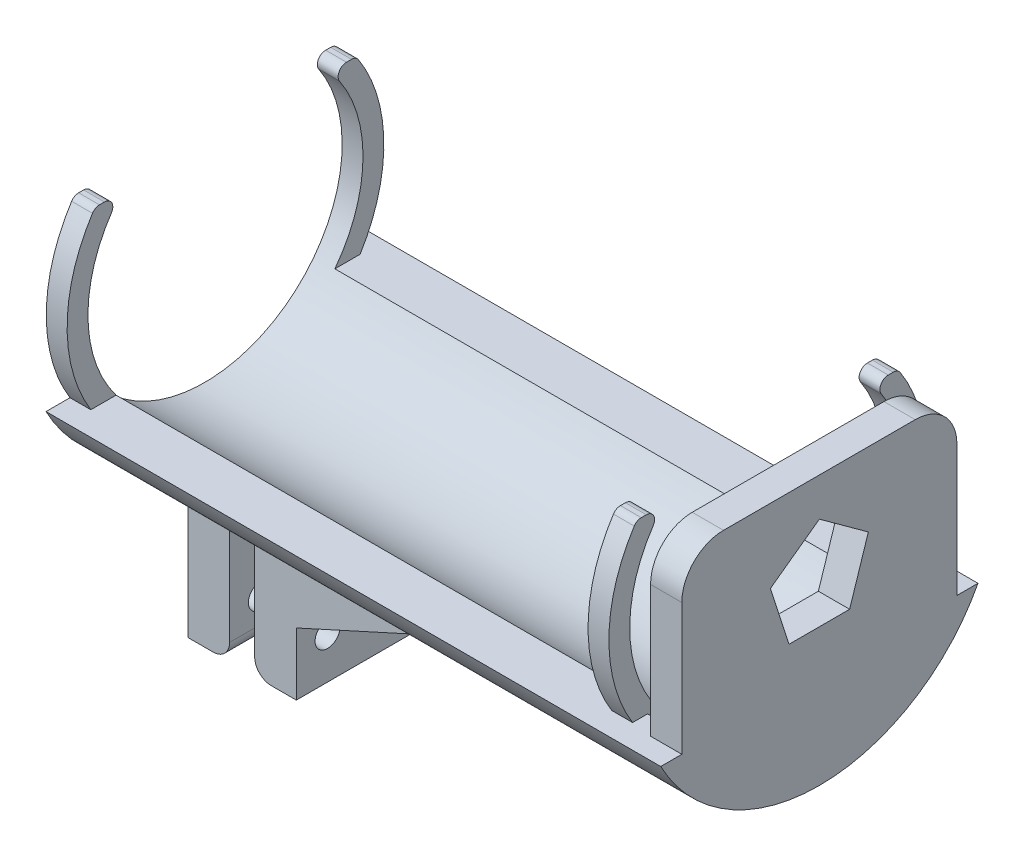
from build123d import *

# Parameters (mm, degrees)
BOSS_EXTRUDE1_DEPTH   = 70
BOSS_EXTRUDE2_START   = -5
BOSS_EXTRUDE2_DEPTH   = 5
BOSS_EXTRUDE3_START   = 7.5
BOSS_EXTRUDE3_DEPTH   = 7.5
BOSS_EXTRUDE4_DEPTH   = 15
BOSS_EXTRUDE4_2_DEPTH = 15
BOSS_EXTRUDE6_REACH   = 109.8
SKETCH5_W             = 43
SKETCH5_H             = 30
SKETCH5_W_2           = 10
CUT_EXTRUDE1_REACH    = 161.406
SKETCH6_R             = 3
SKETCH7_R             = 35
CUT_EXTRUDE2_DEPTH    = 5
LPATTERN1_COUNT       = 2
LPATTERN1_PITCH       = 130
FILLET1_R             = 2
CUT_EXTRUDE3_REACH    = 164.413


with BuildPart() as part:
    # Sketch1 → Boss-Extrude1 (new, symmetric)
    with BuildSketch(Plane(origin=(0, 0, 0), x_dir=(0, 0, -1), z_dir=(1, 0, 0))):
        with BuildLine():
            Line((-38.065732621, -20), (-26.248809497, -20))
            ThreePointArc((-26.248809497, -20), (0, -33), (26.248809497, -20))
            Line((26.248809497, -20), (38.065732621, -20))
            ThreePointArc((38.065732621, -20), (0, -43), (-38.065732621, -20))
        make_face()
    extrude(amount=BOSS_EXTRUDE1_DEPTH, both=True)

    # Sketch2 → Boss-Extrude2 (add)
    with BuildSketch(Plane(origin=(70, 0, 0), x_dir=(0, 0, -1), z_dir=(1, 0, 0)).offset(BOSS_EXTRUDE2_START)):
        with BuildLine():
            Line((-31.304951685, 21.540659229), (-25, 21.540659229))
            ThreePointArc((-25, 21.540659229), (0, -33), (25, 21.540659229))
            Line((25, 21.540659229), (31.304951685, 21.540659229))
            ThreePointArc((31.304951685, 21.540659229), (0, -38), (-31.304951685, 21.540659229))
        make_face()
    boss_extrude2 = extrude(amount=-BOSS_EXTRUDE2_DEPTH)

    # Sketch3 → Boss-Extrude3 (add)
    with BuildSketch(Plane(origin=(70, 0, 0), x_dir=(0, 0, -1), z_dir=(1, 0, 0)).offset(BOSS_EXTRUDE3_START)):
        with BuildLine():
            Line((-33, -20), (-33, 11.540659229))
            ThreePointArc((-33, 11.540659229), (-30.071067812, 18.61172704), (-23, 21.540659229))
            Line((-23, 21.540659229), (23, 21.540659229))
            ThreePointArc((23, 21.540659229), (30.071067812, 18.61172704), (33, 11.540659229))
            Line((33, 11.540659229), (33, -20))
            Line((33, -20), (38.065732621, -20))
            ThreePointArc((38.065732621, -20), (0, -43), (-38.065732621, -20))
            Line((-38.065732621, -20), (-33, -20))
        make_face()
    extrude(amount=-BOSS_EXTRUDE3_DEPTH)

    # Sketch5 → Boss-Extrude6 (add, up to next)
    with BuildSketch(Plane(origin=(0, -43, 0), x_dir=(1, 0, 0), z_dir=(0, 1, 0)), mode=Mode.PRIVATE) as boss_extrude6_sk1:
        with Locations((-21.5, 0)):
            Rectangle(SKETCH5_W, SKETCH5_H)
    boss_extrude6_tool1 = extrude(boss_extrude6_sk1.sketch, amount=BOSS_EXTRUDE6_REACH, mode=Mode.PRIVATE) - part.part
    # Sketch5 → Boss-Extrude6 (add, up to next)
    with BuildSketch(Plane(origin=(0, -43, 0), x_dir=(1, 0, 0), z_dir=(0, 1, 0)), mode=Mode.PRIVATE) as boss_extrude6_sk2:
        with Locations((-54, 0)):
            Rectangle(SKETCH5_W_2, SKETCH5_H)
    boss_extrude6_tool2 = extrude(boss_extrude6_sk2.sketch, amount=BOSS_EXTRUDE6_REACH, mode=Mode.PRIVATE) - part.part


with BuildPart() as body_2:
    # Sketch4 → Boss-Extrude4 (new, symmetric)
    with BuildSketch(Plane.XY):
        with BuildLine():
            Line((-49, -43), (-49, -69))
            ThreePointArc((-49, -69), (-50.171572875, -71.828427125), (-53, -73))
            Line((-53, -73), (-59, -73))
            Line((-59, -73), (-59, -43))
            Line((-59, -43), (-49, -43))
        make_face()
    extrude(amount=BOSS_EXTRUDE4_DEPTH, both=True)


with BuildPart() as body_3:
    # Sketch4 → Boss-Extrude4 2 (new, symmetric)
    with BuildSketch(Plane.XY):
        with BuildLine():
            Line((-33, -43), (-43, -43))
            Line((-43, -43), (-43, -69))
            ThreePointArc((-43, -69), (-41.828427125, -71.828427125), (-39, -73))
            Line((-39, -73), (-33, -73))
            Line((-33, -73), (-33, -58))
            Line((-33, -58), (0, -43))
            Line((0, -43), (-33, -43))
        make_face()
    extrude(amount=BOSS_EXTRUDE4_2_DEPTH, both=True)


with BuildPart() as part_1:
    add(part.part)

    add(body_2.part)  # Boss-Extrude6 merges body 2

    add(body_3.part)  # Boss-Extrude6 merges body 3
    add(boss_extrude6_tool1.solids().sort_by_distance((-21.5, -43, 0))[0])
    add(boss_extrude6_tool1.solids().sort_by_distance((-21.5, -43, 0))[1])
    add(boss_extrude6_tool2.solids().sort_by_distance((-54, -43, 0))[0])
    add(boss_extrude6_tool2.solids().sort_by_distance((-54, -43, 0))[1])

    # Cut-Extrude1: up to this face of the body (flat: up to its plane)
    cut_extrude1_end = Plane(part_1.part.faces().sort_by_distance((-33, -65.5, 0))[0])
    # Sketch6 → Cut-Extrude1 (cut, up to the picked face)
    with BuildSketch(Plane.ZY.offset(59), mode=Mode.PRIVATE) as cut_extrude1_sk1:
        with Locations((-7.5, -63)):
            Circle(SKETCH6_R)
    cut_extrude1_tool1 = split(extrude(cut_extrude1_sk1.sketch, amount=-CUT_EXTRUDE1_REACH, mode=Mode.PRIVATE), bisect_by=cut_extrude1_end, keep=Keep.BOTH, mode=Mode.PRIVATE)
    # Sketch6 → Cut-Extrude1 (cut, up to the picked face)
    with BuildSketch(Plane.ZY.offset(59), mode=Mode.PRIVATE) as cut_extrude1_sk2:
        with Locations((7.5, -63)):
            Circle(SKETCH6_R)
    cut_extrude1_tool2 = split(extrude(cut_extrude1_sk2.sketch, amount=-CUT_EXTRUDE1_REACH, mode=Mode.PRIVATE), bisect_by=cut_extrude1_end, keep=Keep.BOTH, mode=Mode.PRIVATE)
    add(cut_extrude1_tool1.solids().sort_by(Axis((-59, -63, -7.5), (1, 0, 0)))[0], mode=Mode.SUBTRACT)
    add(cut_extrude1_tool2.solids().sort_by(Axis((-59, -63, 7.5), (1, 0, 0)))[0], mode=Mode.SUBTRACT)

    # Sketch7 → Cut-Extrude2 (cut)
    with BuildSketch(Plane.ZY.offset(-70)):
        Circle(SKETCH7_R)
    extrude(amount=CUT_EXTRUDE2_DEPTH, mode=Mode.SUBTRACT)

    # LPattern1: Boss-Extrude2 ×2
    with Locations(*[(-i * LPATTERN1_PITCH, 0, 0) for i in range(1, LPATTERN1_COUNT)]):
        add(boss_extrude2)

    # Fillet1
    fillet1_edges = [part_1.edges().sort_by_distance(p)[0] for p in [
        (62.5, 21.540659229, 25),
        (62.5, 21.540659229, -31.304951685),
        (-67.5, 21.540659229, 25),
        (-67.5, 21.540659229, -31.304951685),
        (-67.5, 21.540659229, -25),
        (-67.5, 21.540659229, 31.304951685),
        (62.5, 21.540659229, -25),
        (62.5, 21.540659229, 31.304951685),
    ]]
    fillet(fillet1_edges, radius=FILLET1_R)

    # Sketch8 → Cut-Extrude3 (cut, up to next)
    with BuildSketch(Plane.ZY.offset(-70), mode=Mode.PRIVATE) as cut_extrude3_sk1:
        Polygon((0, 12.360679775), (-11.755705046, 3.819660113), (-7.26542528, -10), (7.26542528, -10), (11.755705046, 3.819660113), align=None)
    cut_extrude3_tool1 = extrude(cut_extrude3_sk1.sketch, amount=-CUT_EXTRUDE3_REACH, mode=Mode.PRIVATE) & part_1.part
    add(cut_extrude3_tool1.solids().sort_by_distance((70, 0, 0))[0], mode=Mode.SUBTRACT)


solid = part_1.part
